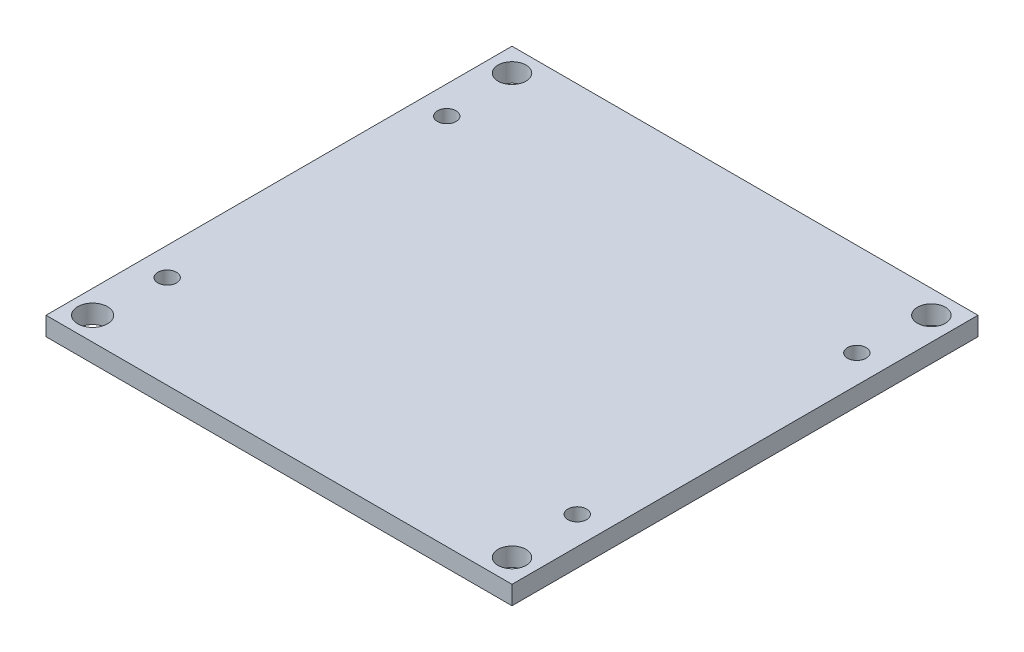
from build123d import *

# Parameters (mm, degrees)
SKETCH1_W                = 50
SKETCH1_H                = 50
BOSS_EXTRUDE1_DEPTH      = 2
M3_CLEARANCE_HOLE1_D     = 3.2
M3_CLEARANCE_HOLE2_D     = 3
M2_CLEARANCE_HOLE1_D     = 2
M2_CLEARANCE_HOLE1_DEPTH = 10
M2_CLEARANCE_HOLE1_TIP   = 0.600860619


with BuildPart() as part:
    # Sketch1 → Boss-Extrude1 (new body)
    with BuildSketch(Plane(origin=(0, 0, 0), x_dir=(1, 0, 0), z_dir=(0, 1, 0))):
        with Locations((25, 25)):
            Rectangle(SKETCH1_W, SKETCH1_H)
    extrude(amount=BOSS_EXTRUDE1_DEPTH)

    # M3 Clearance Hole1 (through all)
    with Locations(Plane(origin=(0, 2, 0), x_dir=(1, 0, 0), z_dir=(0, 1, 0))):
        with Locations((2.5, 2.5)):
            Hole(M3_CLEARANCE_HOLE1_D / 2)

    # M3 Clearance Hole2 (through all)
    with Locations(Plane(origin=(0, 2, 0), x_dir=(1, 0, 0), z_dir=(0, 1, 0))):
        with Locations((47.5, 2.5), (47.5, 47.5), (2.5, 47.5)):
            Hole(M3_CLEARANCE_HOLE2_D / 2)

    # M2 Clearance Hole1
    with Locations(Plane(origin=(0, 2, 0), x_dir=(1, 0, 0), z_dir=(0, 1, 0))):
        with Locations((3, 10), (3, 40), (47, 40), (47, 10)):
            Hole(M2_CLEARANCE_HOLE1_D / 2, depth=M2_CLEARANCE_HOLE1_DEPTH)
            with Locations((0, 0, -(M2_CLEARANCE_HOLE1_DEPTH + M2_CLEARANCE_HOLE1_TIP / 2))):  # 118° drill point
                Cone(0, M2_CLEARANCE_HOLE1_D / 2, M2_CLEARANCE_HOLE1_TIP, mode=Mode.SUBTRACT)


solid = part.part
